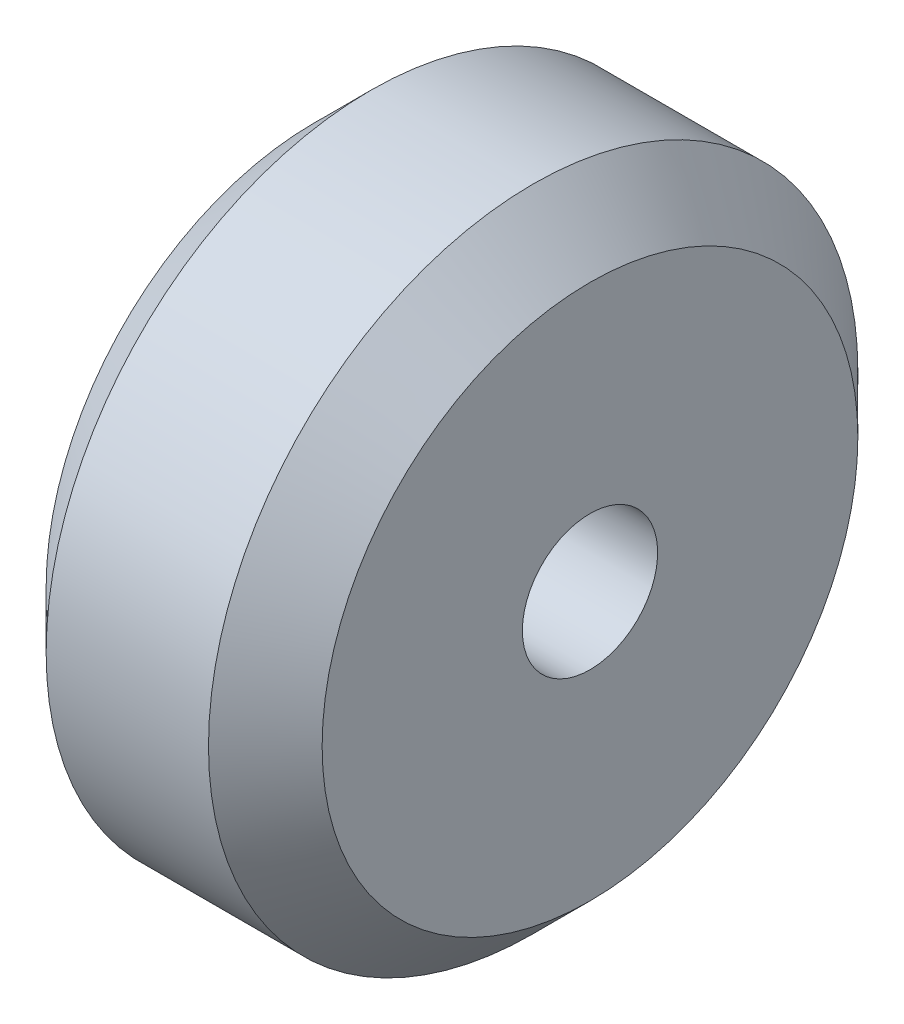
from build123d import *


with BuildPart() as part:
    # Sketch1 → Revolve1 (revolve)
    with BuildSketch(Plane(origin=(0, 0, 0), x_dir=(1, 0, 0), z_dir=(0, 1, 0)), mode=Mode.PRIVATE) as revolve1_sk:
        Polygon((0, 2.5), (0, 9.9), (2.1, 12), (8.1, 12), (10.2, 9.9), (10.2, 2.5), align=None)
    revolve(revolve1_sk.sketch.rotate(Axis((0, 0, 0), (1, 0, 0)), 180), axis=Axis((0, 0, 0), (1, 0, 0)))


solid = part.part
